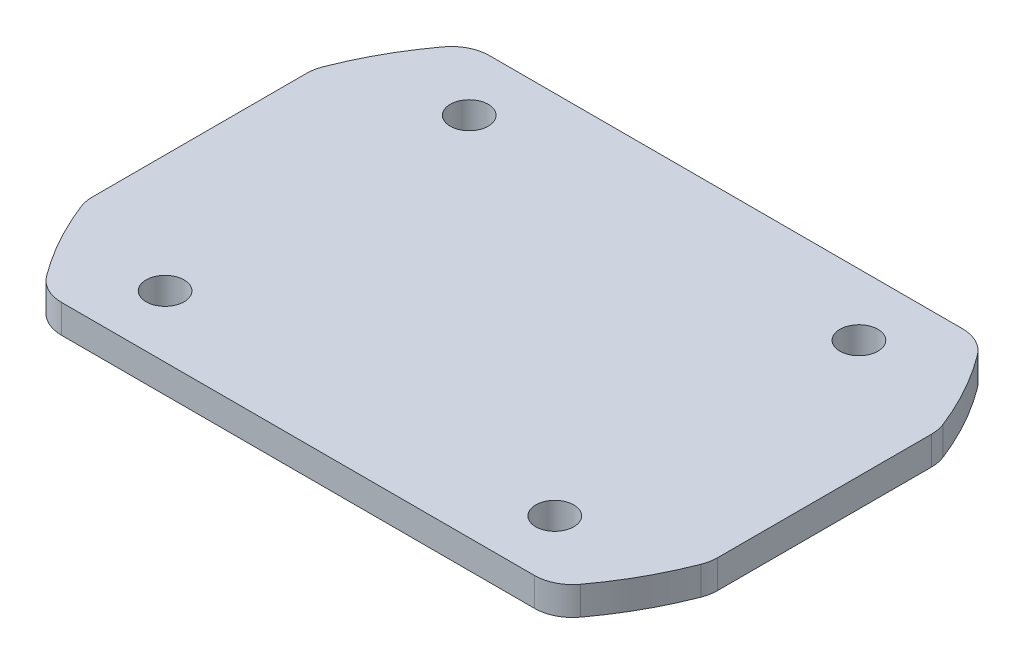
from build123d import *

# Parameters (mm, degrees)
SKETCH_1_R      = 1
EXTRUDE_1_DEPTH = 1.5
FILLET_1_R      = 2


with BuildPart() as part:
    # 草图1 → 凸台-拉伸1 (new body)
    with BuildSketch(Plane(origin=(0, 0, 0), x_dir=(1, 0, 0), z_dir=(0, 1, 0))):
        with BuildLine():
            Line((-13.404756618, 11.25), (13.404756618, 11.25))
            ThreePointArc((13.404756618, 11.25), (15.151148095, 8.757437491), (16.439282223, 6))
            Line((16.439282223, 6), (16.439282223, -6))
            ThreePointArc((16.439282223, -6), (15.151148095, -8.757437491), (13.404756618, -11.25))
            Line((13.404756618, -11.25), (-13.404756618, -11.25))
            ThreePointArc((-13.404756618, -11.25), (-15.151148095, -8.757437491), (-16.439282223, -6))
            Line((-16.439282223, -6), (-16.439282223, 6))
            ThreePointArc((-16.439282223, 6), (-15.151148095, 8.757437491), (-13.404756618, 11.25))
        make_face()
        with Locations(Location((10.25, -8, 0), (0, 0, 270))):
            Circle(SKETCH_1_R, mode=Mode.SUBTRACT)
        with Locations(Location((-10.25, -8, 0), (0, 0, 90))):
            Circle(SKETCH_1_R, mode=Mode.SUBTRACT)
        with Locations(Location((-10.25, 8, 0), (0, 0, 270))):
            Circle(SKETCH_1_R, mode=Mode.SUBTRACT)
        with Locations(Location((10.25, 8, 0), (0, 0, 90))):
            Circle(SKETCH_1_R, mode=Mode.SUBTRACT)
    extrude(amount=EXTRUDE_1_DEPTH)

    # 圆角1
    fillet_1_edges = [part.edges().sort_by_distance(p)[0] for p in [
        (-13.404756618, 0.75, -11.25),
        (13.404756618, 0.75, -11.25),
        (16.439282223, 0.75, -6),
        (16.439282223, 0.75, 6),
        (13.404756618, 0.75, 11.25),
        (-13.404756618, 0.75, 11.25),
        (-16.439282223, 0.75, 6),
        (-16.439282223, 0.75, -6),
    ]]
    fillet(fillet_1_edges, radius=FILLET_1_R)


solid = part.part
